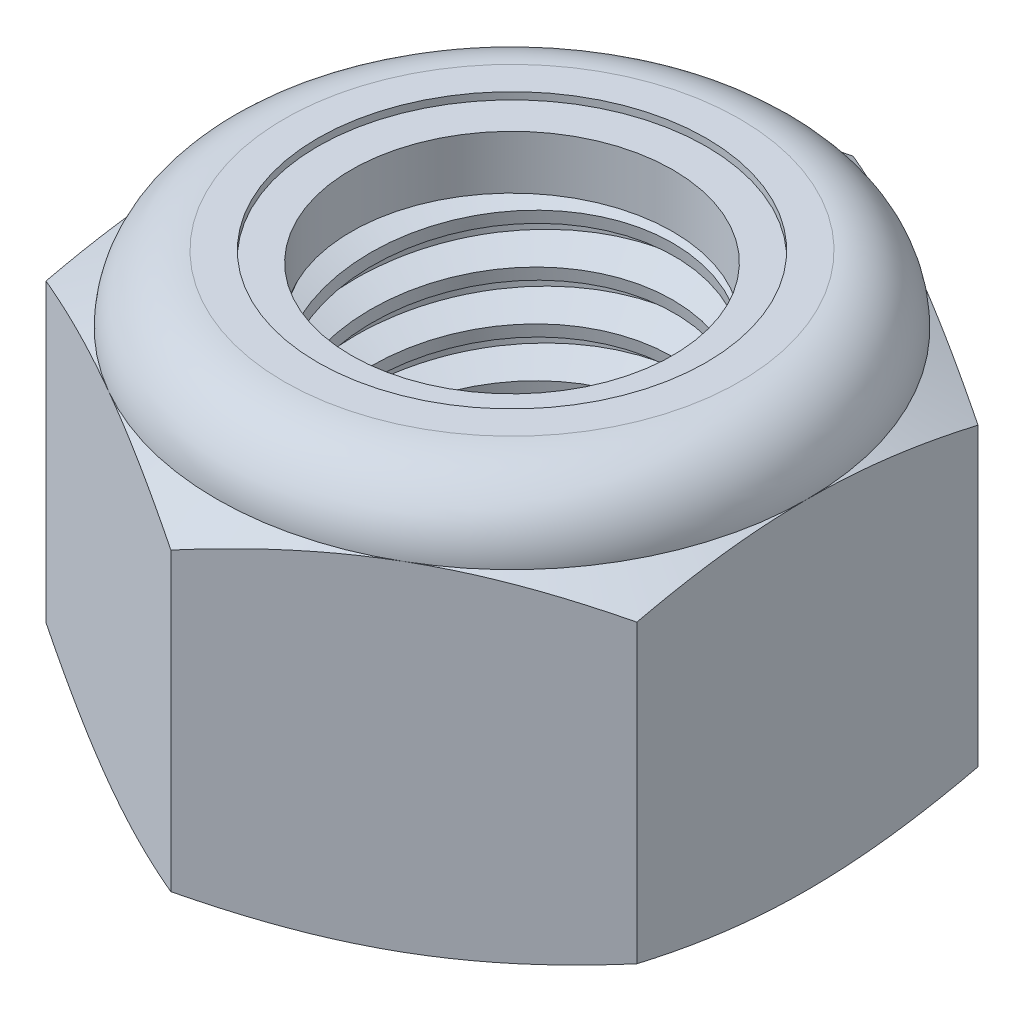
from build123d import *

# Parameters (mm, degrees)
EXTRUDE1_DEPTH      = 8.73125
SKETCH2_W           = 3.9624
SKETCH2_H           = 8.73125
LPATTERN1_COUNT     = 8
LPATTERN1_PITCH     = 1.058333333
LPATTERN1_COL_COUNT = 2
LPATTERN1_COL_PITCH = 1.058333333


with BuildPart() as part:
    # Sketch1 → Extrude1 (new body)
    with BuildSketch(Plane(origin=(0, 0, 0), x_dir=(1, 0, 0), z_dir=(0, 1, 0))):
        Polygon((0, 7.332348419), (-6.35, 3.666174209), (-6.35, -3.666174209), (0, -7.332348419), (6.35, -3.666174209), (6.35, 3.666174209), align=None)
    extrude(amount=EXTRUDE1_DEPTH)

    # Sketch4 → Cut-Revolve2 (revolve, cut)
    with BuildSketch(Plane(origin=(0, 0, 0), x_dir=(0, 0, -1), z_dir=(1, 0, 0)), mode=Mode.PRIVATE) as cut_revolve2_sk:
        Polygon((0, 8.73125), (3.9624, 8.73125), (3.4558921, 8.495061487), (3.4558921, 0.236188513), (3.9624, 0), (0, 0), align=None)
    revolve(cut_revolve2_sk.sketch.rotate(Axis((0, 8.73125, 0), (0, 1, 0)), 54.867789329), axis=Axis((0, 8.73125, 0), (0, 1, 0)), mode=Mode.SUBTRACT)


with BuildPart() as body_2:
    # Sketch2 → Revolve1 (revolve)
    with BuildSketch(Plane(origin=(0, 0, 0), x_dir=(0, 0, -1), z_dir=(1, 0, 0))):
        with Locations((1.9812, 4.365625)):
            Rectangle(SKETCH2_W, SKETCH2_H)
    revolve(axis=Axis((0, -3.9624, 0), (0, 1, 0)))

    # Sketch3 → Cut-Revolve1 (revolve, cut)
    with BuildSketch(Plane(origin=(0, 0, 0), x_dir=(0, 0, -1), z_dir=(1, 0, 0)), mode=Mode.PRIVATE) as cut_revolve1_sk:
        Polygon((3.979911688, 8.600122482), (4.102493502, 7.682229859), (3.490915476, 7.934220821), (3.4558921, 8.196475856), align=None)
    cut_revolve1 = revolve(cut_revolve1_sk.sketch.rotate(Axis((0, 8.73125, 0.150876649), (0, -0.9912001327823777, -0.1323718126044843)), 180), axis=Axis((0, 8.73125, 0.150876649), (0, -0.9912001327823777, -0.1323718126044843)), mode=Mode.SUBTRACT)

    # LPattern1: Cut-Revolve1 ×8
    with Locations(*[(0, -i * LPATTERN1_PITCH, 0) for i in range(1, LPATTERN1_COUNT)]):
        add(cut_revolve1, mode=Mode.SUBTRACT)

    # LPattern1 col: Cut-Revolve1 ×2
    with Locations(*[(0, i * LPATTERN1_COL_PITCH, 0) for i in range(1, LPATTERN1_COL_COUNT)]):
        add(cut_revolve1, mode=Mode.SUBTRACT)


with BuildPart() as part_1:
    add(part.part)

    # Combine1: cut body 2
    add(body_2.part, mode=Mode.SUBTRACT)

    # Sketch5 → Cut-Revolve3 (revolve, cut)
    with BuildSketch(Plane(origin=(0, 0, 0), x_dir=(0, 0, -1), z_dir=(1, 0, 0)), mode=Mode.PRIVATE) as cut_revolve3_sk:
        with BuildLine():
            Line((0, 0), (6.35, 0))
            Line((6.35, 0), (7.332348419, 0.458076591))
            Line((7.332348419, 0.458076591), (7.332348419, 6.817965076))
            Line((7.332348419, 6.817965076), (6.35, 7.276041667))
            ThreePointArc((6.35, 7.276041667), (5.923779347, 8.305029347), (4.894791667, 8.73125))
            Line((4.894791667, 8.73125), (4.894791667, 10.00125))
            Line((4.894791667, 10.00125), (8.602348419, 10.00125))
            Line((8.602348419, 10.00125), (8.602348419, -1.27))
            Line((8.602348419, -1.27), (0, -1.27))
            Line((0, -1.27), (0, 0))
        make_face()
    revolve(cut_revolve3_sk.sketch.rotate(Axis((0, 0, 0), (0, 1, 0)), 54.867789329), axis=Axis((0, 0, 0), (0, 1, 0)), mode=Mode.SUBTRACT)

    # Sketch6 → Cut-Revolve4 (revolve, cut)
    with BuildSketch(Plane(origin=(0, 0, 0), x_dir=(0, 0, -1), z_dir=(1, 0, 0)), mode=Mode.PRIVATE) as cut_revolve4_sk:
        with BuildLine():
            Line((0, 7.276041667), (6.1976, 7.276041667))
            ThreePointArc((6.1976, 7.276041667), (5.816016274, 8.197266274), (4.894791667, 8.57885))
            Line((4.894791667, 8.57885), (4.175341883, 8.57885))
            Line((4.175341883, 8.57885), (4.175341883, 10.00125))
            Line((4.175341883, 10.00125), (0, 10.00125))
            Line((0, 10.00125), (0, 7.276041667))
        make_face()
    revolve(cut_revolve4_sk.sketch.rotate(Axis((0, 10.00125, 0), (0, 1, 0)), 54.867789329), axis=Axis((0, 10.00125, 0), (0, 1, 0)), mode=Mode.SUBTRACT)


with BuildPart() as body_2_2:
    # Sketch7 → Revolve2 (revolve)
    with BuildSketch(Plane(origin=(0, 0, 0), x_dir=(0, 0, -1), z_dir=(1, 0, 0)), mode=Mode.PRIVATE) as revolve2_sk:
        with BuildLine():
            Line((3.4558921, 7.352241667), (6.119030844, 7.352241667))
            ThreePointArc((6.119030844, 7.352241667), (5.734762038, 8.169919611), (4.894791667, 8.50265))
            Line((4.894791667, 8.50265), (3.4558921, 8.50265))
            Line((3.4558921, 8.50265), (3.4558921, 7.352241667))
        make_face()
    revolve(revolve2_sk.sketch.rotate(Axis((0, 7.352241667, 0), (0, 1, 0)), 54.867789329), axis=Axis((0, 7.352241667, 0), (0, 1, 0)))


solid = Compound([part_1.part, body_2_2.part])
